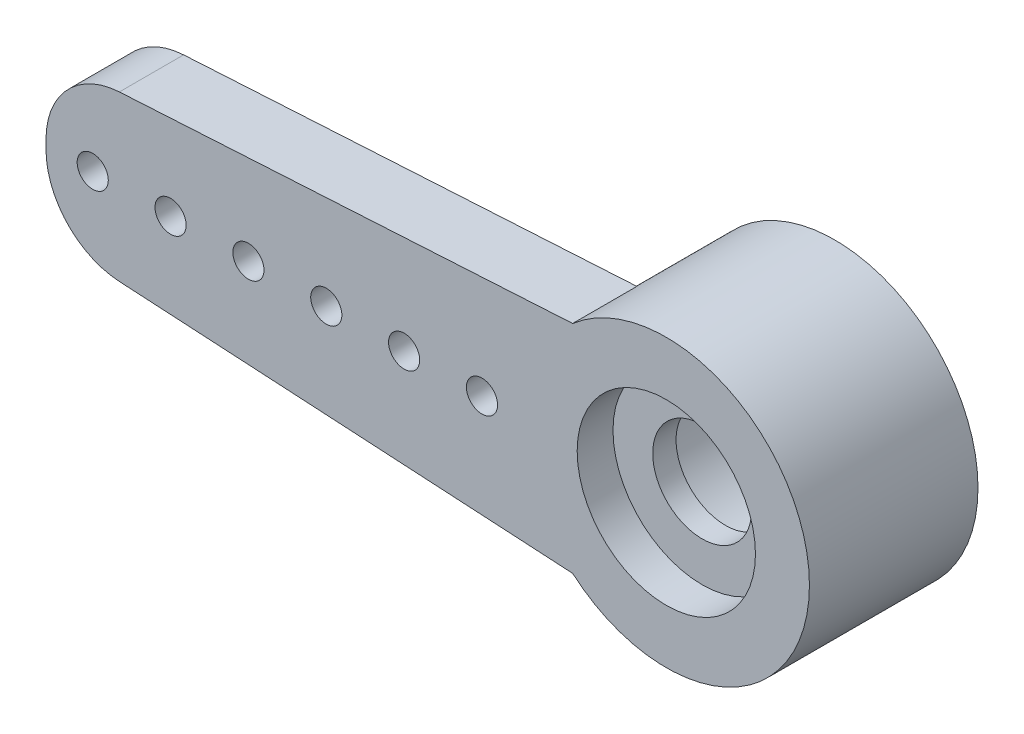
from build123d import *

# Parameters (mm, degrees)
SKETCH1_R           = 3.67665
BOSS_EXTRUDE1_DEPTH = 4.33
SKETCH2_R           = 2.235
CUT_EXTRUDE1_DEPTH  = 2.81
SKETCH3_R           = 2.29
CUT_EXTRUDE2_DEPTH  = 0.92
SKETCH4_R           = 1.27
CUT_EXTRUDE3_DEPTH  = 7.218006951
BOSS_EXTRUDE2_START = -1.65
BOSS_EXTRUDE2_DEPTH = 1.65
FILLET1_R           = 2
SKETCH6_R           = 0.4
CUT_EXTRUDE4_DEPTH  = 17.917177076


with BuildPart() as part:
    # Sketch1 → Boss-Extrude1 (new body)
    with BuildSketch(Plane.XY):
        Circle(SKETCH1_R)
    extrude(amount=BOSS_EXTRUDE1_DEPTH)

    # Sketch2 → Cut-Extrude1 (cut)
    with BuildSketch(Plane(origin=(0, 0, 0), x_dir=(-1, 0, 0), z_dir=(0, 0, -1))):
        Circle(SKETCH2_R)
    extrude(amount=-CUT_EXTRUDE1_DEPTH, mode=Mode.SUBTRACT)

    # Sketch3 → Cut-Extrude2 (cut)
    with BuildSketch(Plane.XY.offset(4.33)):
        Circle(SKETCH3_R)
    extrude(amount=-CUT_EXTRUDE2_DEPTH, mode=Mode.SUBTRACT)

    # Sketch4 → Cut-Extrude3 (cut, through all)
    with BuildSketch(Plane.XY.offset(3.41)):
        Circle(SKETCH4_R)
    extrude(amount=-CUT_EXTRUDE3_DEPTH, mode=Mode.SUBTRACT)

    # Sketch5 → Boss-Extrude2 (add)
    with BuildSketch(Plane.XY.offset(4.33).offset(BOSS_EXTRUDE2_START)):
        with BuildLine():
            ThreePointArc((-2.406107899, -2.78), (-3.67665, 0), (-2.406107899, 2.78))
            Line((-2.406107899, 2.78), (-15.935, 2))
            Line((-15.935, 2), (-15.935, -2))
            Line((-15.935, -2), (-2.406107899, -2.78))
        make_face()
    extrude(amount=BOSS_EXTRUDE2_DEPTH)

    # Fillet1
    fillet1_edges = [part.edges().sort_by_distance(p)[0] for p in [
        (-15.935, -2, 3.505),
        (-15.935, 2, 3.505),
    ]]
    fillet(fillet1_edges, radius=FILLET1_R)

    # Sketch6 → Cut-Extrude4 (cut, through all)
    with BuildSketch(Plane.XY.offset(4.33)):
        with Locations((-14.735, 0)):
            Circle(SKETCH6_R)
        with Locations((-12.735, 0)):
            Circle(SKETCH6_R)
        with Locations((-10.735, 0)):
            Circle(SKETCH6_R)
        with Locations((-8.735, 0)):
            Circle(SKETCH6_R)
        with Locations((-6.735, 0)):
            Circle(SKETCH6_R)
        with Locations((-4.735, 0)):
            Circle(SKETCH6_R)
    extrude(amount=-CUT_EXTRUDE4_DEPTH, mode=Mode.SUBTRACT)


solid = part.part
